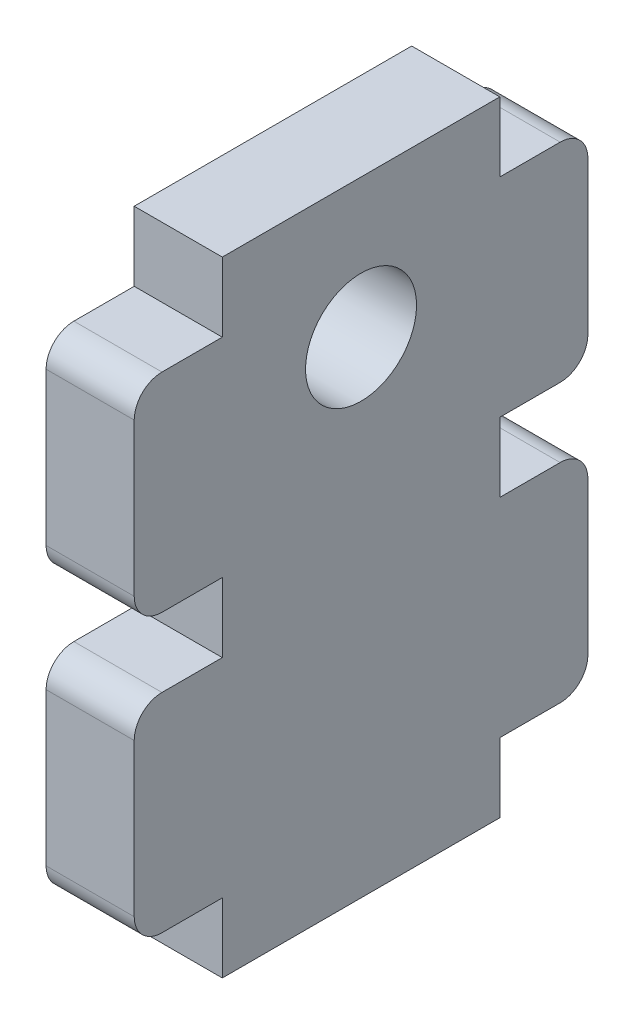
from build123d import *

# Parameters (mm, degrees)
BOSS_EXTRUDE1_DEPTH = 6.35
FILLET1_R           = 2
SKETCH2_R           = 4
CUT_EXTRUDE1_DEPTH  = 53.532323383


with BuildPart() as part:
    # Sketch1 → Boss-Extrude1 (new body)
    with BuildSketch(Plane(origin=(0, 0, 0), x_dir=(0, 0, -1), z_dir=(1, 0, 0))):
        Polygon((0, 40), (0, 45), (20, 45), (20, 40), (26.35, 40), (26.35, 25), (20, 25), (20, 20), (26.35, 20), (26.35, 5), (20, 5), (20, 0), (0, 0), (0, 5), (-6.35, 5), (-6.35, 20), (0, 20), (0, 25), (-6.35, 25), (-6.35, 40), align=None)
    extrude(amount=BOSS_EXTRUDE1_DEPTH)

    # Fillet1
    fillet1_edges = [part.edges().sort_by_distance(p)[0] for p in [
        (3.175, 5, 6.35),
        (3.175, 20, 6.35),
        (3.175, 25, 6.35),
        (3.175, 40, 6.35),
        (3.175, 40, -26.35),
        (3.175, 25, -26.35),
        (3.175, 20, -26.35),
        (3.175, 5, -26.35),
    ]]
    fillet(fillet1_edges, radius=FILLET1_R)

    # Sketch2 → Cut-Extrude1 (cut, through all)
    with BuildSketch(Plane(origin=(6.35, 0, 0), x_dir=(0, 0, -1), z_dir=(1, 0, 0))):
        with Locations((10, 35)):
            Circle(SKETCH2_R)
    extrude(amount=-CUT_EXTRUDE1_DEPTH, mode=Mode.SUBTRACT)


solid = part.part
